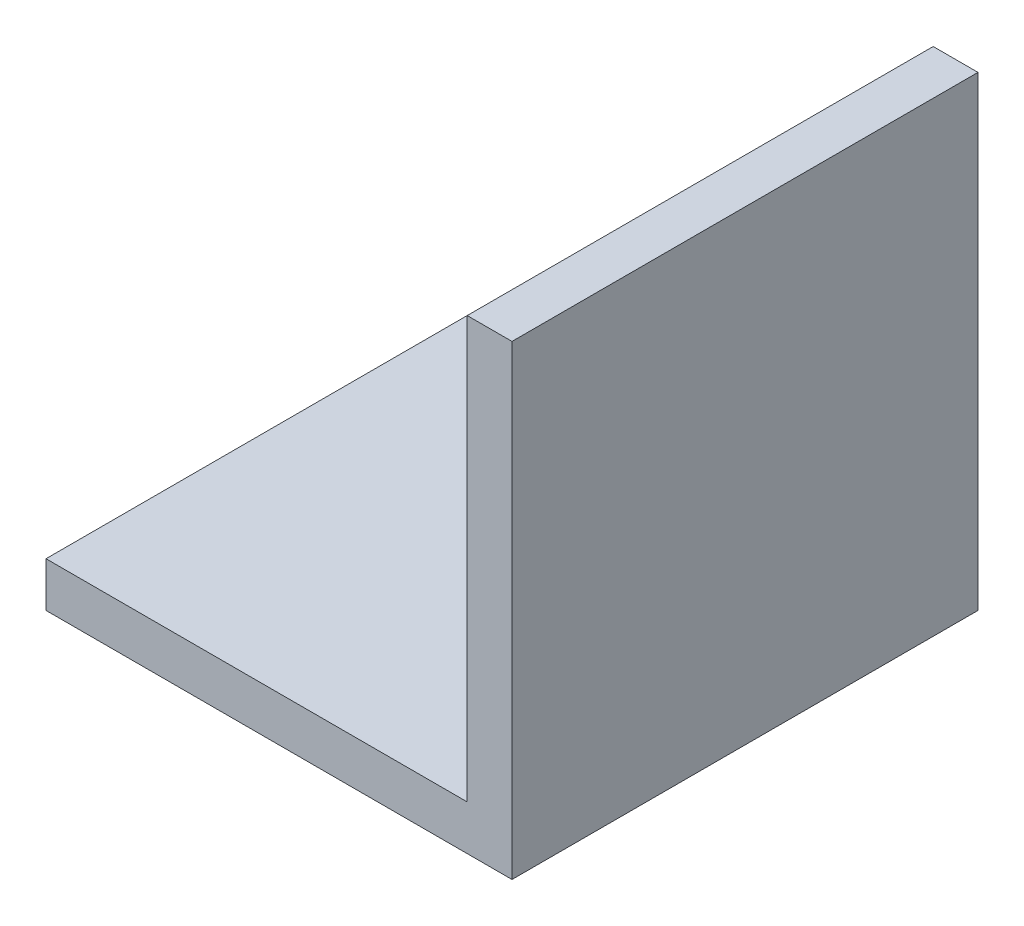
from build123d import *

# Parameters (mm, degrees)
BOSS_EXTRUDE1_DEPTH = 41.275


with BuildPart() as part:
    # Sketch1 → Boss-Extrude1 (new body)
    with BuildSketch(Plane.XY):
        Polygon((-28.879916159, -5.541730183), (12.395083841, -5.541730183), (12.395083841, 35.733269817), (8.426333841, 35.733269817), (8.426333841, -1.572980183), (-28.879916159, -1.572980183), align=None)
    extrude(amount=BOSS_EXTRUDE1_DEPTH)


solid = part.part
